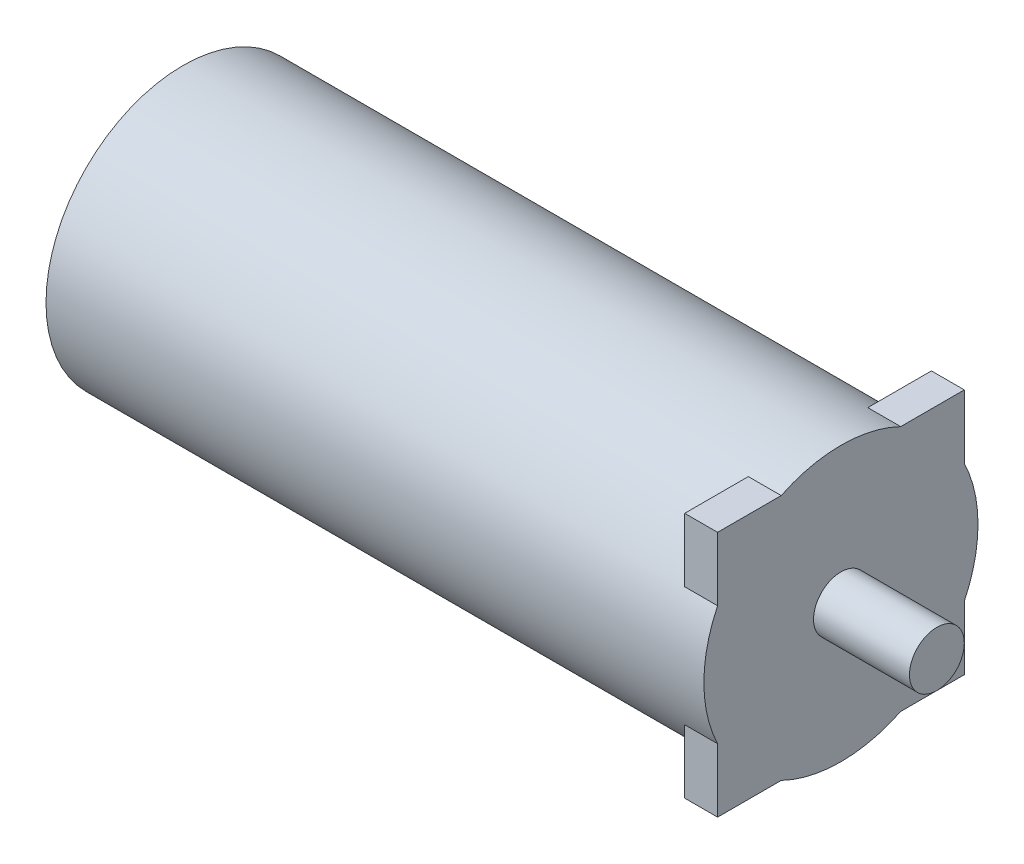
from build123d import *

# Parameters (mm, degrees)
SKETCH1_W           = 90
SKETCH1_H           = 90
BOSS_EXTRUDE1_DEPTH = 12
SKETCH2_R           = 50
BOSS_EXTRUDE2_DEPTH = 240
SKETCH3_R           = 10
BOSS_EXTRUDE3_DEPTH = 35


with BuildPart() as part:
    # Sketch1 → Boss-Extrude1 (new body)
    with BuildSketch(Plane.YZ):
        Rectangle(SKETCH1_W, SKETCH1_H)
    extrude(amount=-BOSS_EXTRUDE1_DEPTH)

    # Sketch2 → Boss-Extrude2 (add)
    with BuildSketch(Plane.YZ):
        with Locations(Location((0, 0, 0), (0, 0, 270))):
            Circle(SKETCH2_R)
    extrude(amount=-BOSS_EXTRUDE2_DEPTH)

    # Sketch3 → Boss-Extrude3 (add)
    with BuildSketch(Plane(origin=(0, 0, 0), x_dir=(0, 0, -1), z_dir=(1, 0, 0))):
        with Locations(Location((0, 0, 0), (0, 0, 180))):
            Circle(SKETCH3_R)
    extrude(amount=BOSS_EXTRUDE3_DEPTH)


solid = part.part
